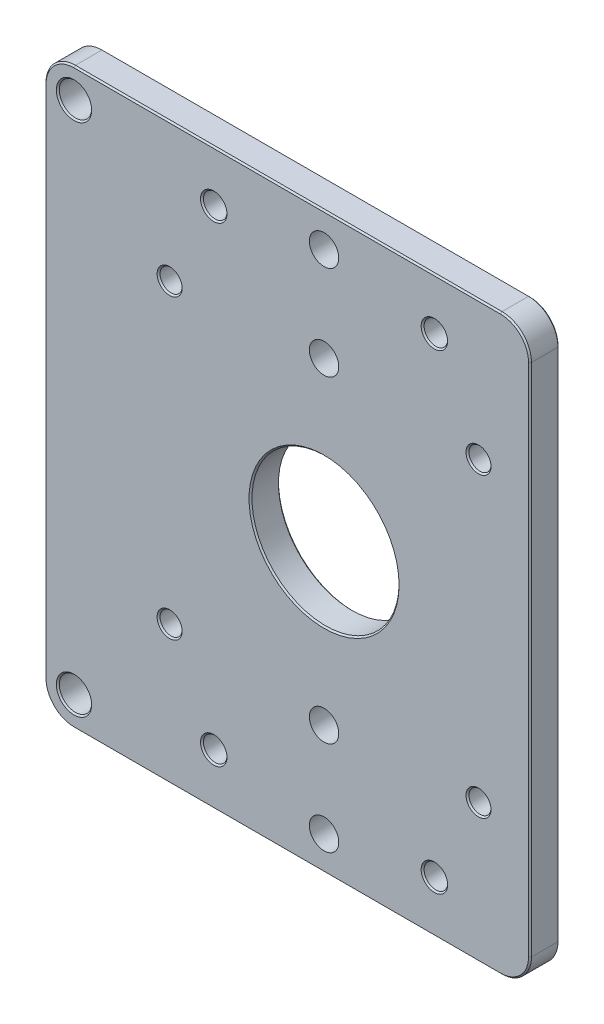
from build123d import *

# Parameters (mm, degrees)
SKETCH_2_W                  = 38
SKETCH_2_H                  = 39
EXTRUDE_1_DEPTH             = 2
CHAMFER_3_SIZE              = 1
SKETCH_7_R                  = 5
CUT_EXTRUDE_3_DEPTH         = 10
SKETCH_8_W                  = 2
SKETCH_8_H                  = 39
CUT_EXTRUDE_4_DEPTH         = 10
FILLET_3_R                  = 2
SKETCH_9_R                  = 2
EXTRUDE_1_2_DEPTH           = 23
SKETCH_10_W                 = 3
SKETCH_10_H                 = 39
CUT_EXTRUDE_1_DEPTH         = 10
FILLET_5_R                  = 2
CHAMFER_5_SIZE              = 0.5
HOLE_WIZARD_M2_1_D          = 1.6
HOLE_WIZARD_2_2_2_2_1_D     = 2.2
HOLE_WIZARD_2_2_2_2_1_DEPTH = 114
HOLE_WIZARD_2_2_2_2_1_TIP   = 0.660946681
SKETCH_24_W                 = 68.041100534
SKETCH_24_H                 = 56.84151123
CUT_EXTRUDE_3_2_DEPTH       = 95
HOLE_WIZARD_1_5_1_5_1_D     = 1.5
HOLE_WIZARD_1_5_1_5_1_DEPTH = 43
HOLE_WIZARD_1_5_1_5_1_TIP   = 0.450645464
CHAMFER_6_SIZE              = 0.1
CHAMFER_7_SIZE              = 0.1
HOLE_WIZARD_2_0_2_1_D       = 2


with BuildPart() as part:
    # 草图2 → Extrude 1 (new body)
    with BuildSketch(Plane.XY):
        Rectangle(SKETCH_2_W, SKETCH_2_H)
    extrude(amount=EXTRUDE_1_DEPTH)

    # 倒角3
    chamfer_3_edges = [part.edges().sort_by_distance(p)[0] for p in [
        (-19, 19.5, 1),
        (-19, -19.5, 1),
    ]]
    chamfer(chamfer_3_edges, length=CHAMFER_3_SIZE)

    # 草图7 → Cut-Extrude 3 (cut)
    with BuildSketch(Plane.XY.offset(2)):
        with Locations((2, 0)):
            Circle(SKETCH_7_R)
    extrude(amount=-CUT_EXTRUDE_3_DEPTH, mode=Mode.SUBTRACT)

    # 草图8 → 拉伸4 (cut)
    with BuildSketch(Plane.XY.offset(2)):
        with Locations((-18, 0)):
            Rectangle(SKETCH_8_W, SKETCH_8_H)
    extrude(amount=-CUT_EXTRUDE_4_DEPTH, mode=Mode.SUBTRACT)

    # 圆角3
    fillet_3_edges = [part.edges().sort_by_distance(p)[0] for p in [
        (-17, 19.5, 1),
        (-17, -19.5, 1),
    ]]
    fillet(fillet_3_edges, radius=FILLET_3_R)

    # 草图9 → Extrude 1 2 (add)
    with BuildSketch(Plane.XY.offset(2)):
        with Locations((-15, 17.5)):
            Circle(SKETCH_9_R)
        with Locations((-15, -17.5)):
            Circle(SKETCH_9_R)
    extrude_1_2 = extrude(amount=EXTRUDE_1_2_DEPTH)

    # 镜向1: Extrude 1 2 across plane
    add(extrude_1_2.mirror(Plane.ZX))

    # 草图10 → 切除-拉伸1 (cut)
    with BuildSketch(Plane(origin=(0, 0, 0), x_dir=(-1, 0, 0), z_dir=(0, 0, -1))):
        with Locations((-17.5, 0)):
            Rectangle(SKETCH_10_W, SKETCH_10_H)
    extrude(amount=-CUT_EXTRUDE_1_DEPTH, mode=Mode.SUBTRACT)

    # 圆角5
    fillet_5_edges = [part.edges().sort_by_distance(p)[0] for p in [
        (16, -19.5, 1),
        (16, 19.5, 1),
    ]]
    fillet(fillet_5_edges, radius=FILLET_5_R)

    # 倒角5
    chamfer_5_edges = [part.edges().sort_by_distance(p)[0] for p in [
        (-17, 17.5, 25),
        (-17, -17.5, 25),
    ]]
    chamfer(chamfer_5_edges, length=CHAMFER_5_SIZE)

    # M2 螺纹孔1 (through all)
    with Locations(Plane(origin=(9.5, 16, 0), x_dir=(-1, 0, 0), z_dir=(0, 0, -1))):
        with Locations((0, 0), (15, 0), (0, -32), (15, -32)):
            Hole(HOLE_WIZARD_M2_1_D / 2)

    # Ø2.2 (2.2) 直径孔1
    with Locations(Plane(origin=(-15, 17.5, 25), x_dir=(1, 0, 0), z_dir=(0, 0, 1))):
        with Locations((0, 0), (0, -35)):
            Hole(HOLE_WIZARD_2_2_2_2_1_D / 2, depth=HOLE_WIZARD_2_2_2_2_1_DEPTH)
            with Locations((0, 0, -(HOLE_WIZARD_2_2_2_2_1_DEPTH + HOLE_WIZARD_2_2_2_2_1_TIP / 2))):  # 118° drill point
                Cone(0, HOLE_WIZARD_2_2_2_2_1_D / 2, HOLE_WIZARD_2_2_2_2_1_TIP, mode=Mode.SUBTRACT)

    # 草图24 → Cut-Extrude 3 2 (cut)
    with BuildSketch(Plane.XY.offset(2)):
        Rectangle(SKETCH_24_W, SKETCH_24_H)
    extrude(amount=CUT_EXTRUDE_3_2_DEPTH, mode=Mode.SUBTRACT)

    # Ø1.5 (1.5) 直径孔1
    with Locations(Plane(origin=(12.5, 10.1, 0), x_dir=(-1, 0, 0), z_dir=(0, 0, -1))):
        with Locations((0, 0), (21, 0), (21, -20.2), (0, -20.2)):
            Hole(HOLE_WIZARD_1_5_1_5_1_D / 2, depth=HOLE_WIZARD_1_5_1_5_1_DEPTH)
            with Locations((0, 0, -(HOLE_WIZARD_1_5_1_5_1_DEPTH + HOLE_WIZARD_1_5_1_5_1_TIP / 2))):  # 118° drill point
                Cone(0, HOLE_WIZARD_1_5_1_5_1_D / 2, HOLE_WIZARD_1_5_1_5_1_TIP, mode=Mode.SUBTRACT)

    # 倒角6
    chamfer_6_edges = [part.edges().sort_by_distance(p)[0] for p in [
        (-13.9, 17.5, 0),
        (-13.9, -17.5, 0),
        (8.7, 16, 0),
        (-6.3, 16, 0),
        (8.7, -16, 0),
        (15.414213562, 18.914213562, 0),
        (-0.5, 19.5, 0),
        (-16.414213562, 18.914213562, 0),
        (-17, 0, 0),
        (-16.414213562, -18.914213562, 0),
        (-0.5, -19.5, 0),
        (15.414213562, -18.914213562, 0),
        (16, 0, 0),
        (-3, 0, 0),
        (-6.3, -16, 0),
        (11.75, -10.1, 0),
        (-9.25, -10.1, 0),
        (-9.25, 10.1, 0),
        (11.75, 10.1, 0),
    ]]
    chamfer(chamfer_6_edges, length=CHAMFER_6_SIZE)

    # 倒角7
    chamfer_7_edges = [part.edges().sort_by_distance(p)[0] for p in [
        (-13.9, -17.5, 2),
        (-13.9, 17.5, 2),
        (8.7, 16, 2),
        (-6.3, 16, 2),
        (8.7, -16, 2),
        (-6.3, -16, 2),
        (-16.414213562, -18.914213562, 2),
        (-17, 0, 2),
        (-13.9, 17.5, 2),
        (-0.5, 19.5, 2),
        (15.414213562, 18.914213562, 2),
        (16, 0, 2),
        (15.414213562, -18.914213562, 2),
        (-0.5, -19.5, 2),
        (-3, 0, 2),
        (11.75, -10.1, 2),
        (-9.25, -10.1, 2),
        (-9.25, 10.1, 2),
        (11.75, 10.1, 2),
    ]]
    chamfer(chamfer_7_edges, length=CHAMFER_7_SIZE)

    # Ø2.0 (2) 直径孔1 (through all)
    with Locations(Plane(origin=(2, 10.8, 0), x_dir=(-1, 0, 0), z_dir=(0, 0, -1))):
        with Locations((0, 0), (0, 6.4)):
            hole_wizard_2_0_2_1 = Hole(HOLE_WIZARD_2_0_2_1_D / 2)

    # 镜向3: Ø2.0 (2) 直径孔1 across plane
    add(hole_wizard_2_0_2_1.mirror(Plane.ZX), mode=Mode.SUBTRACT)


solid = part.part
